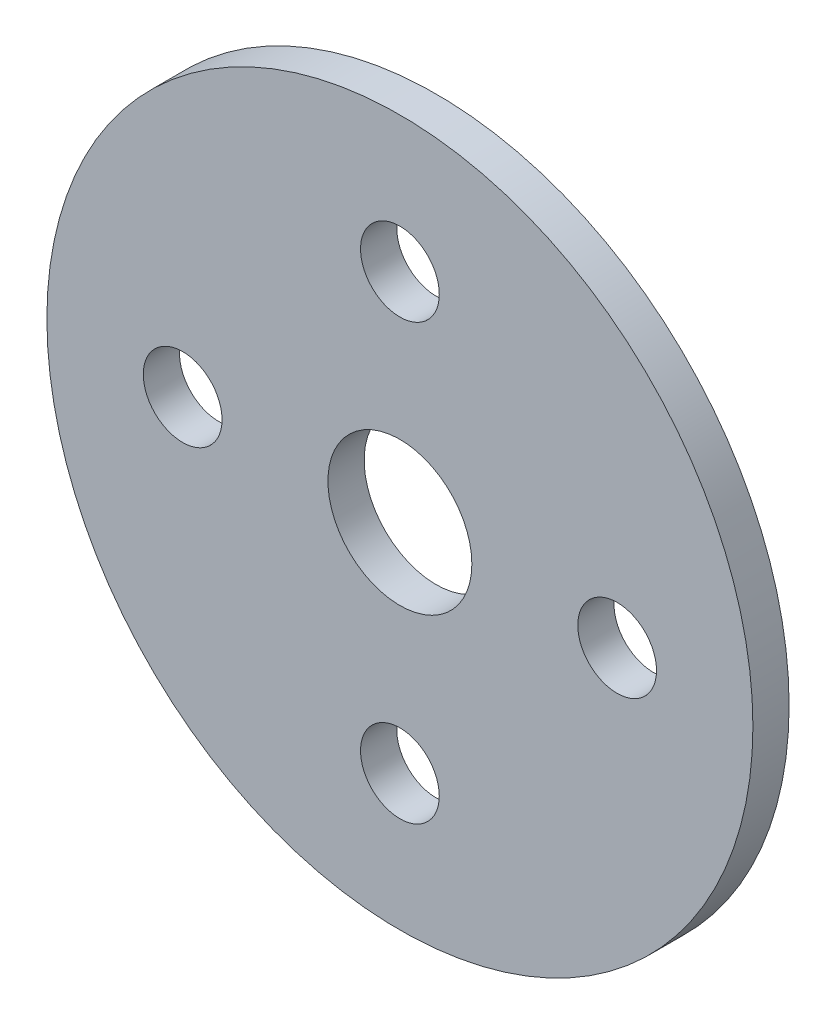
from build123d import *

# Parameters (mm, degrees)
SKETCH1_R           = 19.5
SKETCH1_R_2         = 2.175
SKETCH1_R_3         = 3.975
BOSS_EXTRUDE1_DEPTH = 2


with BuildPart() as part:
    # Sketch1 → Boss-Extrude1 (new body)
    with BuildSketch(Plane.XY):
        Circle(SKETCH1_R)
        with Locations((12, 0)):
            Circle(SKETCH1_R_2, mode=Mode.SUBTRACT)
        with Locations((0, 12)):
            Circle(SKETCH1_R_2, mode=Mode.SUBTRACT)
        with Locations((-12, 0)):
            Circle(SKETCH1_R_2, mode=Mode.SUBTRACT)
        with Locations((0, -12)):
            Circle(SKETCH1_R_2, mode=Mode.SUBTRACT)
        Circle(SKETCH1_R_3, mode=Mode.SUBTRACT)
    extrude(amount=BOSS_EXTRUDE1_DEPTH)


solid = part.part
